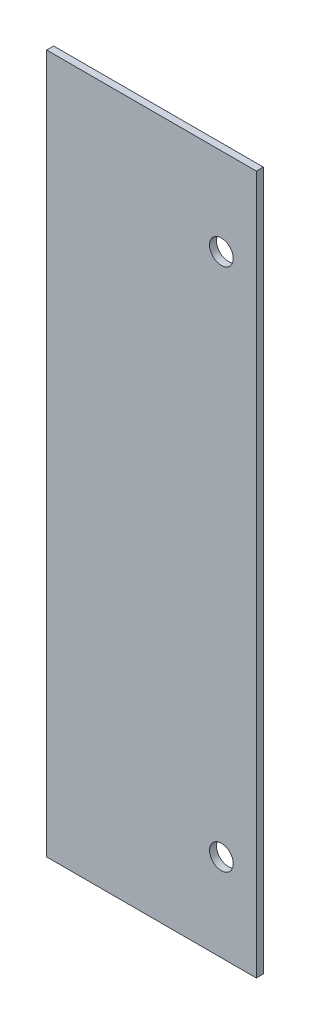
from build123d import *

# Parameters (mm, degrees)
SKETCH1_W               = 30
SKETCH1_H               = 100
BOSS_EXTRUDE1_DEPTH     = 1
CUT_EXTRUDE1_DEPTH      = 53.211109929
CUT_EXTRUDE1_DEPTH_BACK = 53.211109929
SKETCH2_R               = 1.7


with BuildPart() as part:
    # Sketch1 → Boss-Extrude1 (new body)
    with BuildSketch(Plane.XY):
        Rectangle(SKETCH1_W, SKETCH1_H)
    extrude(amount=-BOSS_EXTRUDE1_DEPTH)

    # Sketch2 → Cut-Extrude1 (cut, two sides: drawn at the far end of the back side and taken through both)
    with BuildSketch(Plane.XY.offset(-CUT_EXTRUDE1_DEPTH_BACK)):
        with Locations((10, -37.5)):
            Circle(SKETCH2_R)
        with Locations((10, 37.5)):
            Circle(SKETCH2_R)
    extrude(amount=CUT_EXTRUDE1_DEPTH + CUT_EXTRUDE1_DEPTH_BACK, mode=Mode.SUBTRACT)


solid = part.part
